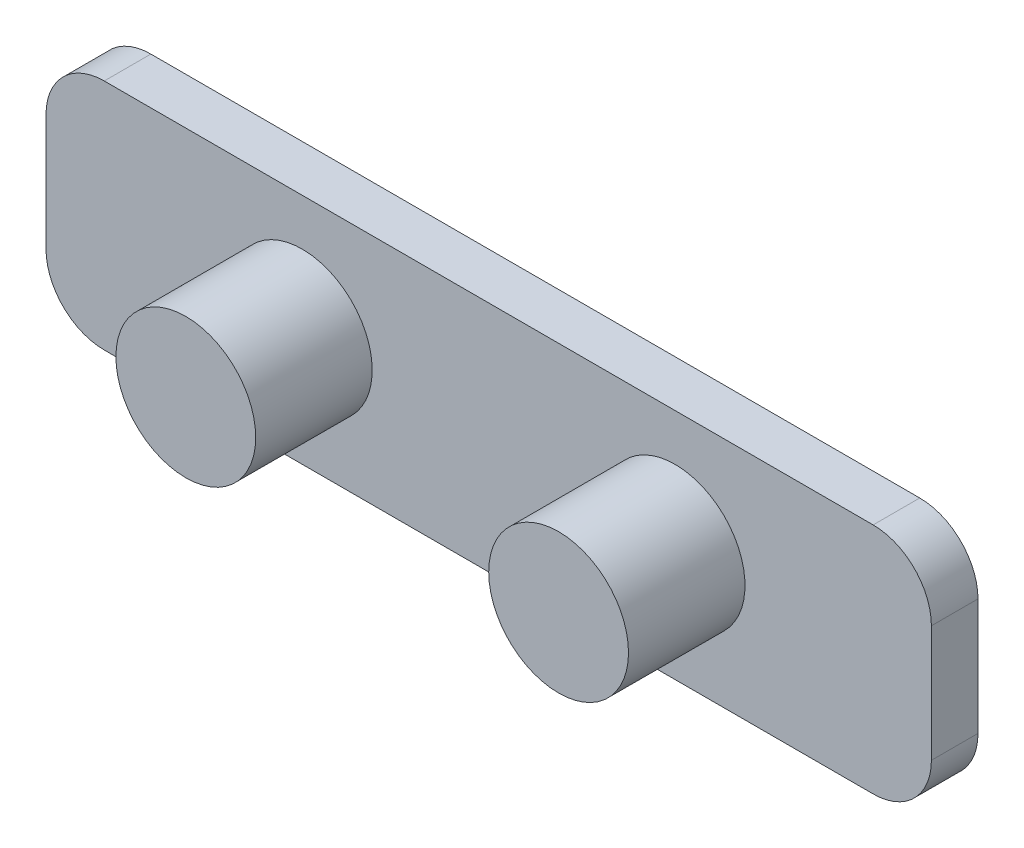
from build123d import *

# Parameters (mm, degrees)
BOSS_EXTRUDE1_DEPTH = 2
SKETCH2_R           = 3
BOSS_EXTRUDE2_DEPTH = 5


with BuildPart() as part:
    # Sketch1 → Boss-Extrude1 (new body)
    with BuildSketch(Plane.XY):
        with BuildLine():
            Line((-5.313337951, 3.839414132), (27.686662049, 3.839414132))
            ThreePointArc((27.686662049, 3.839414132), (29.454429002, 3.107181085), (30.186662049, 1.339414132))
            Line((30.186662049, 1.339414132), (30.186662049, -3.660585868))
            ThreePointArc((30.186662049, -3.660585868), (29.454429002, -5.428352821), (27.686662049, -6.160585868))
            Line((27.686662049, -6.160585868), (-5.313337951, -6.160585868))
            ThreePointArc((-5.313337951, -6.160585868), (-7.081104904, -5.428352821), (-7.813337951, -3.660585868))
            Line((-7.813337951, -3.660585868), (-7.813337951, 1.339414132))
            ThreePointArc((-7.813337951, 1.339414132), (-7.081104904, 3.107181085), (-5.313337951, 3.839414132))
        make_face()
    extrude(amount=BOSS_EXTRUDE1_DEPTH)

    # Sketch2 → Boss-Extrude2 (add)
    with BuildSketch(Plane.XY.offset(2)):
        with Locations(Location((3.186662049, -1.160585868, 0), (0, 0, 180))):
            Circle(SKETCH2_R)
        with Locations(Location((19.186662049, -1.160585868, 0), (0, 0, 180))):
            Circle(SKETCH2_R)
    extrude(amount=BOSS_EXTRUDE2_DEPTH)


solid = part.part
